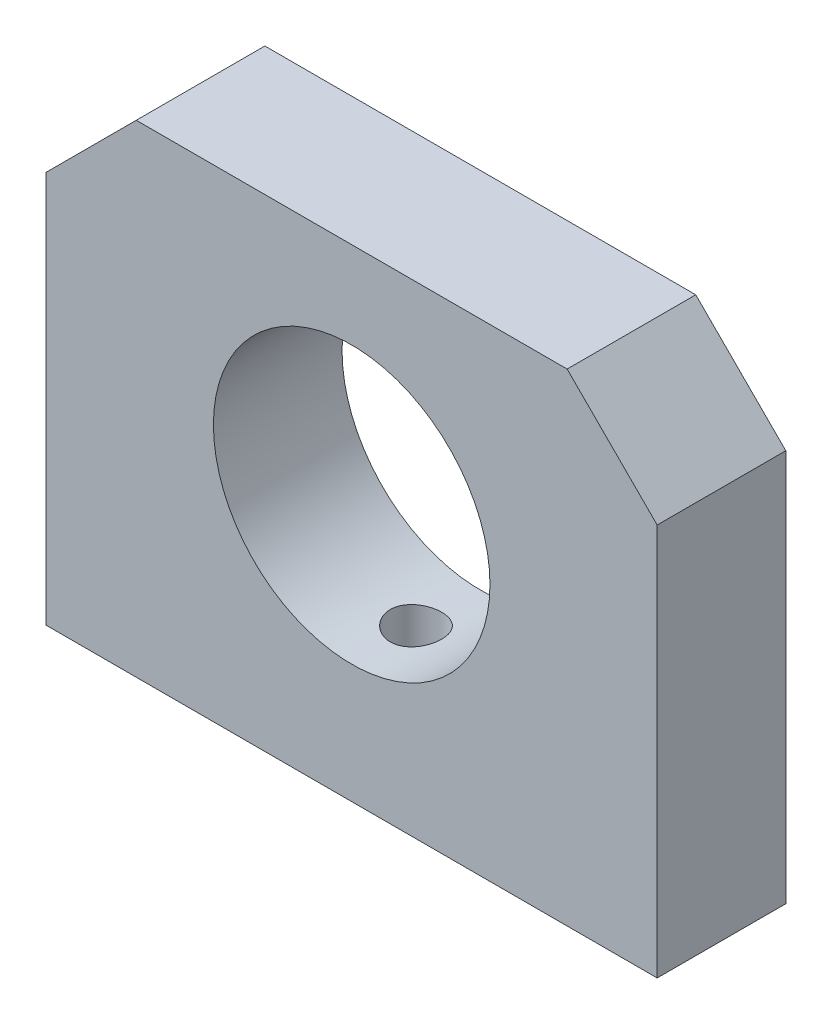
from build123d import *

# Parameters (mm, degrees)
SCHIZZO1_R                   = 21.5
ESTRUSIONE_ESTRUSIONE1_DEPTH = 20
SCHIZZO2_R                   = 4
TAGLIO_ESTRUSIONE1_DEPTH     = 20


with BuildPart() as part:
    # Schizzo1 → Estrusione-Estrusione1 (new body)
    with BuildSketch(Plane.XY):
        Polygon((0, 0), (95, 0), (95, 61), (81, 75), (14, 75), (0, 61), align=None)
        with Locations((47.5, 40)):
            Circle(SCHIZZO1_R, mode=Mode.SUBTRACT)
    extrude(amount=ESTRUSIONE_ESTRUSIONE1_DEPTH)

    # Schizzo2 → Taglio-Estrusione1 (cut)
    with BuildSketch(Plane.XZ):
        with Locations(Location((47.5, 10, 0), (0, 0, 270))):
            Circle(SCHIZZO2_R)
        with Locations(Location((17.5, 10, 0), (0, 0, 270))):
            Circle(SCHIZZO2_R)
        with Locations(Location((77.5, 10, 0), (0, 0, 90))):
            Circle(SCHIZZO2_R)
    extrude(amount=-TAGLIO_ESTRUSIONE1_DEPTH, mode=Mode.SUBTRACT)


solid = part.part
